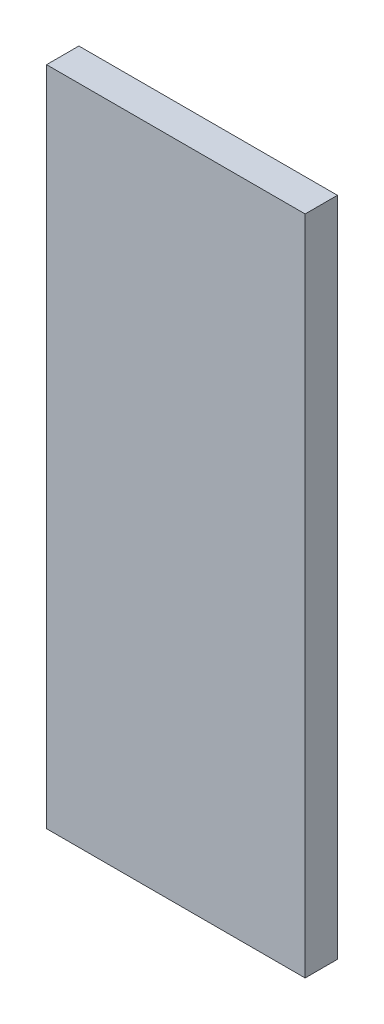
from build123d import *

# Parameters (mm, degrees)
CROQUIS1_W              = 101.6
CROQUIS1_H              = 260
SALIENTE_EXTRUIR1_DEPTH = 12.7


with BuildPart() as part:
    # Croquis1 → Saliente-Extruir1 (new body)
    with BuildSketch(Plane.XY):
        Rectangle(CROQUIS1_W, CROQUIS1_H)
    extrude(amount=SALIENTE_EXTRUIR1_DEPTH)


solid = part.part
